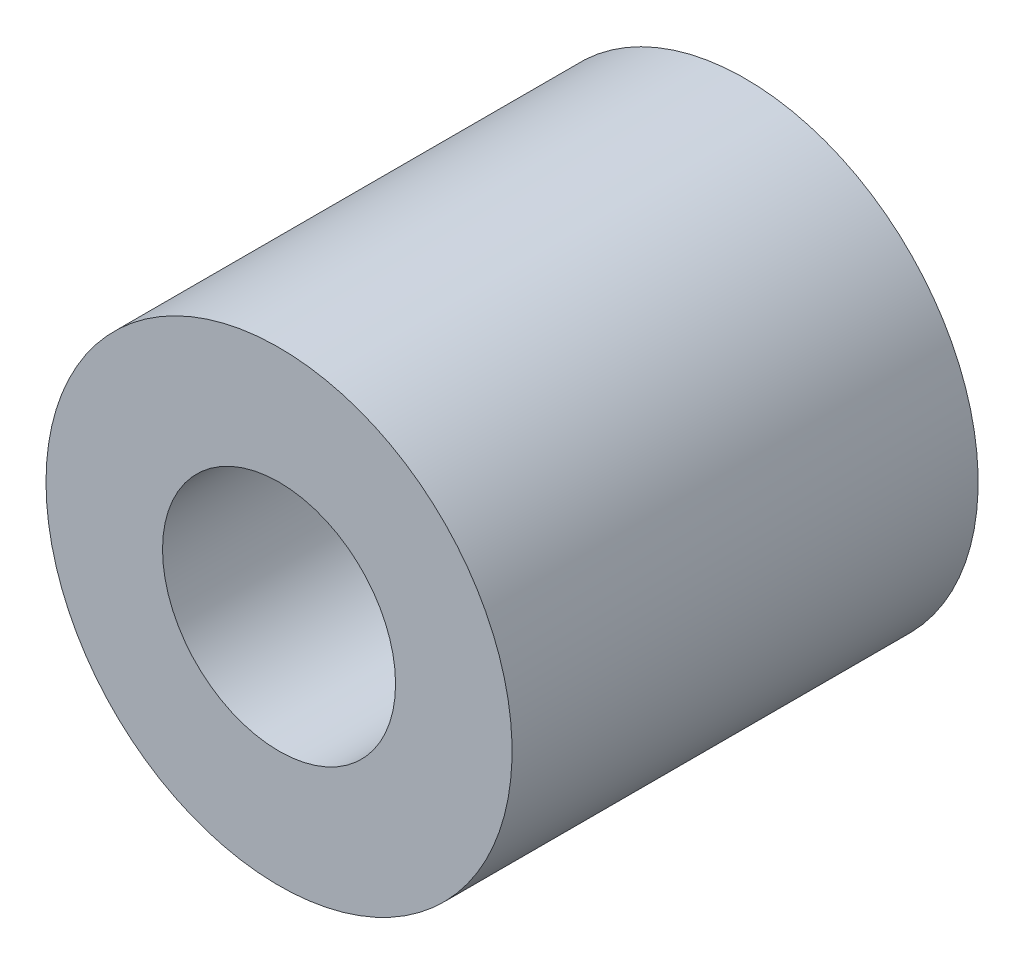
from build123d import *

# Parameters (mm, degrees)
ANNULUSPROFILE_W = 3
ANNULUSPROFILE_H = 12


with BuildPart() as part:
    # AnnulusProfile → Revolution (revolve)
    with BuildSketch(Plane(origin=(0, 0, 0), x_dir=(1, 0, 0), z_dir=(0, 1, 0)), mode=Mode.PRIVATE) as revolution_sk:
        with Locations((4.5, -6)):
            Rectangle(ANNULUSPROFILE_W, ANNULUSPROFILE_H)
    revolve(revolution_sk.sketch.rotate(Axis((0, 0, 0), (0, 0, 1)), 180), axis=Axis((0, 0, 0), (0, 0, 1)))


solid = part.part
